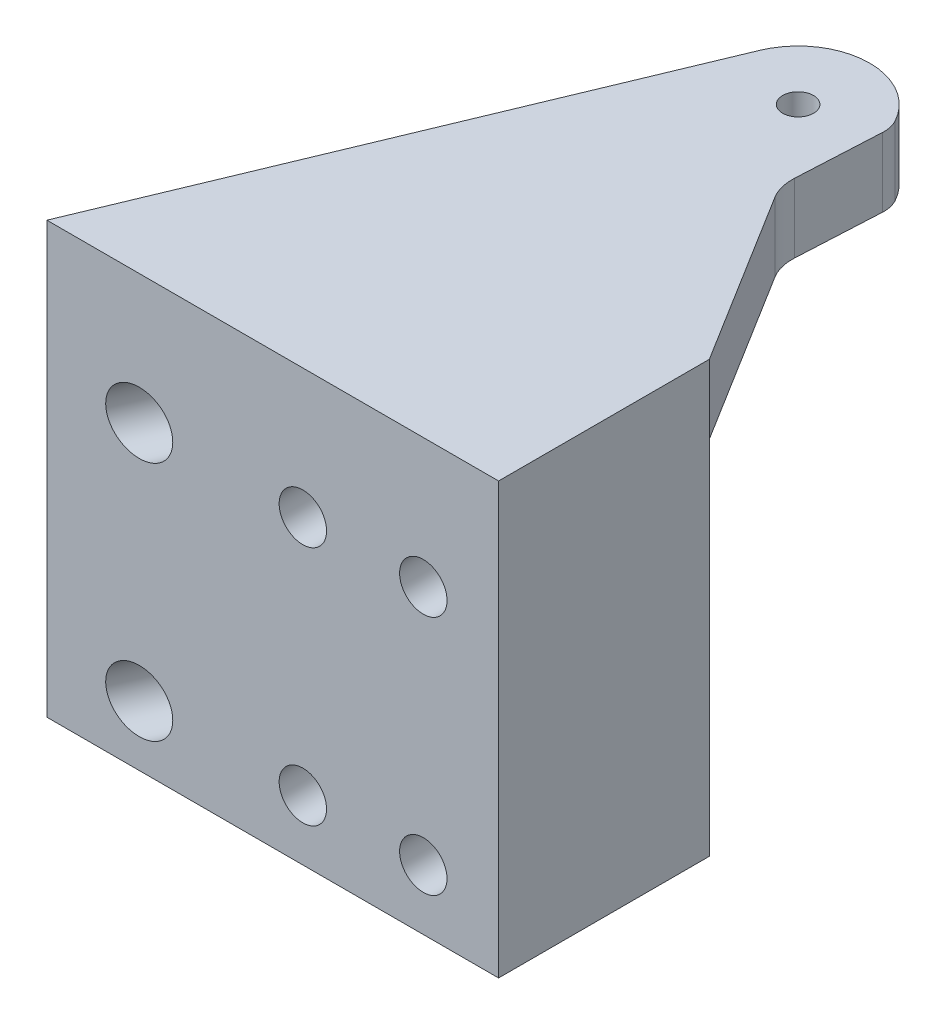
from build123d import *

# Parameters (mm, degrees)
BOSS_EXTRUDE1_DEPTH = 48
SKETCH4_R           = 3.15
SKETCH4_R_2         = 2
CUT_EXTRUDE2_DEPTH  = 4.7
BOSS_EXTRUDE3_START = -48
SKETCH6_R           = 2.05
BOSS_EXTRUDE3_DEPTH = 9.18
SKETCH4_3_R         = 2
CUT_EXTRUDE3_DEPTH  = 8
FILLET3_R           = 4
FILLET4_R           = 6
BOSS_EXTRUDE4_START = -48
BOSS_EXTRUDE4_DEPTH = 48
CUT_EXTRUDE6_START  = -5
SKETCH3_R           = 4.1
CUT_EXTRUDE6_DEPTH  = 66
SKETCH3_3_R         = 2.05
CUT_EXTRUDE7_DEPTH  = 7


with BuildPart() as part:
    # Sketch2 → Boss-Extrude1 (new body)
    with BuildSketch(Plane(origin=(0, 0, 0), x_dir=(1, 0, 0), z_dir=(0, 1, 0))):
        Polygon((0, 0), (0, -15.62924514), (0, -43.62924514), (36.820194138, -43.62924514), (36.820194138, -15.62924514), align=None)
    extrude(amount=BOSS_EXTRUDE1_DEPTH)

    # Sketch4 → Cut-Extrude2 (cut)
    # profile 1 of 8: a face of its own
    with BuildSketch(Plane.XY.offset(43.62924514)):
        with Locations((10.820194138, 40)):
            Circle(SKETCH4_R)
        with Locations((10.820194138, 40)):
            Circle(SKETCH4_R_2, mode=Mode.SUBTRACT)
    # profile 2 of 8: a face of its own
    with BuildSketch(Plane.XY.offset(43.62924514)):
        with Locations((10.820194138, 40)):
            Circle(SKETCH4_R_2)
    # profile 3 of 8: a face of its own
    with BuildSketch(Plane.XY.offset(43.62924514)):
        with Locations((26.820194138, 40)):
            Circle(SKETCH4_R)
        with Locations((26.820194138, 40)):
            Circle(SKETCH4_R_2, mode=Mode.SUBTRACT)
    # profile 4 of 8: a face of its own
    with BuildSketch(Plane.XY.offset(43.62924514)):
        with Locations((26.820194138, 40)):
            Circle(SKETCH4_R_2)
    # profile 5 of 8: a face of its own
    with BuildSketch(Plane.XY.offset(43.62924514)):
        with Locations((26.820194138, 8)):
            Circle(SKETCH4_R)
        with Locations((26.820194138, 8)):
            Circle(SKETCH4_R_2, mode=Mode.SUBTRACT)
    # profile 6 of 8: a face of its own
    with BuildSketch(Plane.XY.offset(43.62924514)):
        with Locations((26.820194138, 8)):
            Circle(SKETCH4_R_2)
    # profile 7 of 8: a face of its own
    with BuildSketch(Plane.XY.offset(43.62924514)):
        with Locations((10.820194138, 8)):
            Circle(SKETCH4_R)
        with Locations((10.820194138, 8)):
            Circle(SKETCH4_R_2, mode=Mode.SUBTRACT)
    # profile 8 of 8: a face of its own
    with BuildSketch(Plane.XY.offset(43.62924514)):
        with Locations((10.820194138, 8)):
            Circle(SKETCH4_R_2)
    extrude(amount=-CUT_EXTRUDE2_DEPTH, mode=Mode.SUBTRACT)

    # Sketch6 → Boss-Extrude3 (add)
    with BuildSketch(Plane.XZ.offset(BOSS_EXTRUDE3_START)):
        with BuildLine():
            Line((21.555608411, -8.941223432), (36.820194138, 15.62924514))
            Line((36.820194138, 15.62924514), (36.820194138, 43.62924514))
            Line((36.820194138, 43.62924514), (-23.179805862, 43.62924514))
            Line((-23.179805862, 43.62924514), (4.617828, -23.236779181))
            ThreePointArc((4.617828, -23.236779181), (13.54895559, -29.088670071), (22.279280146, -22.941223432))
            Line((22.279280146, -22.941223432), (21.555608411, -8.941223432))
        make_face()
        with Locations(Location((13.39, -19.59, 0), (0, 0, 90))):
            Circle(SKETCH6_R, mode=Mode.SUBTRACT)
    extrude(amount=-BOSS_EXTRUDE3_DEPTH)

    # Sketch4<3> → Cut-Extrude3 (cut)
    with BuildSketch(Plane.XY.offset(43.62924514)):
        with Locations((10.820194138, 40)):
            Circle(SKETCH4_3_R)
        with Locations((26.820194138, 40)):
            Circle(SKETCH4_3_R)
        with Locations((26.820194138, 8)):
            Circle(SKETCH4_3_R)
        with Locations((10.820194138, 8)):
            Circle(SKETCH4_3_R)
    extrude(amount=-CUT_EXTRUDE3_DEPTH, mode=Mode.SUBTRACT)

    # Fillet3
    fillet3_edges = [part.edges().sort_by_distance(p)[0] for p in [
        (22.279280146, 52.59, -22.941223432),
    ]]
    fillet(fillet3_edges, radius=FILLET3_R)

    # Fillet4
    fillet4_edges = [part.edges().sort_by_distance(p)[0] for p in [
        (21.555608411, 52.59, -8.941223432),
    ]]
    fillet(fillet4_edges, radius=FILLET4_R)

    # Sketch6<4> → Boss-Extrude4 (add)
    with BuildSketch(Plane.XZ.offset(BOSS_EXTRUDE4_START)):
        Polygon((-23.179805862, 43.62924514), (0, 0), (0, 43.62924514), align=None)
        Polygon((-4.239616227, -1.930574343), (0, 0), (-23.179805862, 43.62924514), align=None)
    extrude(amount=BOSS_EXTRUDE4_DEPTH)

    # Sketch3 → Cut-Extrude6 (cut)
    with BuildSketch(Plane(origin=(0, 0, 0), x_dir=(-0.9205048534524429, 0, -0.3907311284892679), z_dir=(0.3907311284892679, 0, -0.9205048534524429)).offset(CUT_EXTRUDE6_START)):
        with Locations((-7, 40)):
            Circle(SKETCH3_R)
        with Locations((-7, 8)):
            Circle(SKETCH3_R)
    extrude(amount=-CUT_EXTRUDE6_DEPTH, mode=Mode.SUBTRACT)

    # Sketch3<3> → Cut-Extrude7 (cut)
    with BuildSketch(Plane(origin=(0, 0, 0), x_dir=(-0.9205048534524429, 0, -0.3907311284892679), z_dir=(0.3907311284892679, 0, -0.9205048534524429))):
        with Locations((-7, 40)):
            Circle(SKETCH3_3_R)
        with Locations((-7, 8)):
            Circle(SKETCH3_3_R)
    extrude(amount=-CUT_EXTRUDE7_DEPTH, mode=Mode.SUBTRACT)


solid = part.part
